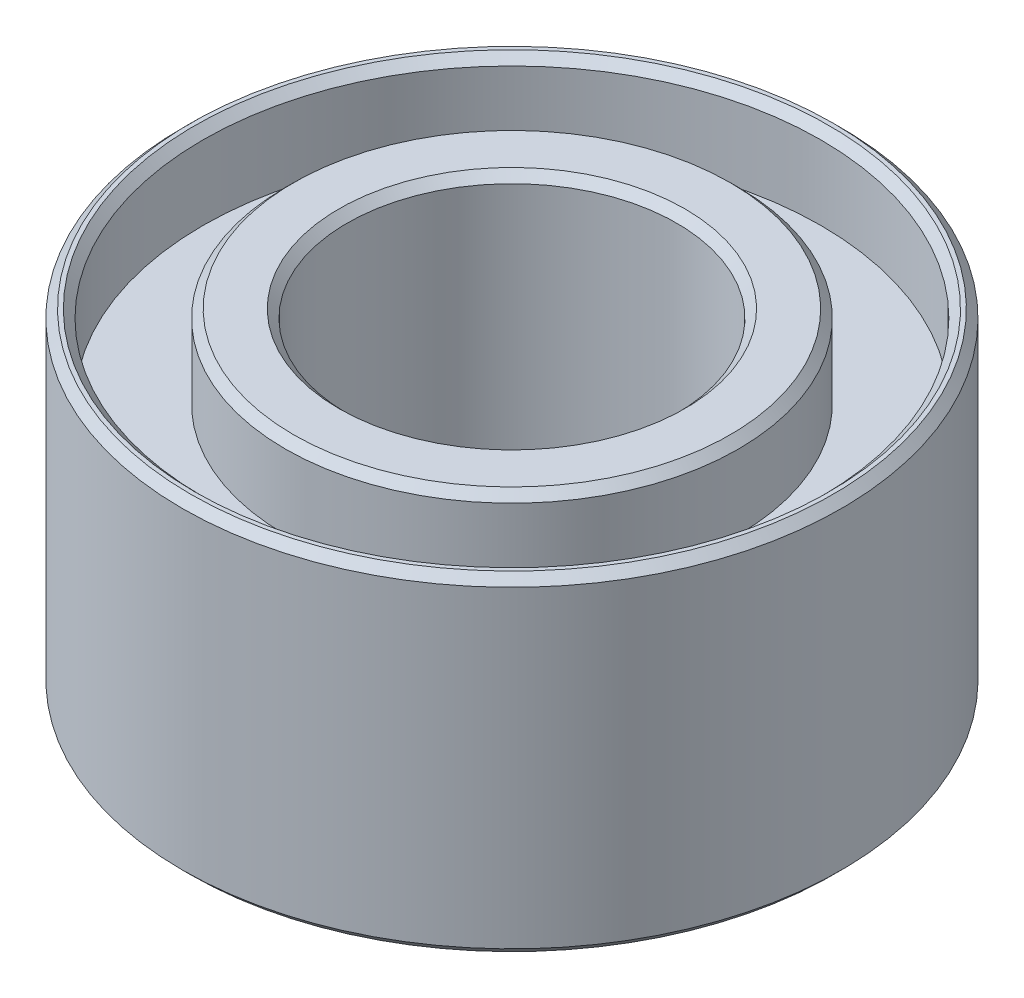
from build123d import *

# Parameters (mm, degrees)
SKETCH1_R           = 4
SKETCH1_R_2         = 2
BOSS_EXTRUDE1_DEPTH = 4
SKETCH2_R           = 3.75
SKETCH2_R_2         = 2.75
CUT_EXTRUDE1_DEPTH  = 1
CUT_EXTRUDE2_START  = -1
SKETCH3_R           = 3.75
SKETCH3_R_2         = 2.75
CUT_EXTRUDE2_DEPTH  = 1
CHAMFER1_SIZE       = 0.1


with BuildPart() as part:
    # Sketch1 → Boss-Extrude1 (new body)
    with BuildSketch(Plane(origin=(0, 0, 0), x_dir=(1, 0, 0), z_dir=(0, 1, 0))):
        with Locations(Location((0, 0, 0), (0, 0, 270))):
            Circle(SKETCH1_R)
        with Locations(Location((0, 0, 0), (0, 0, 270))):
            Circle(SKETCH1_R_2, mode=Mode.SUBTRACT)
    extrude(amount=BOSS_EXTRUDE1_DEPTH)

    # Sketch2 → Cut-Extrude1 (cut)
    with BuildSketch(Plane(origin=(0, 4, 0), x_dir=(1, 0, 0), z_dir=(0, 1, 0))):
        with Locations(Location((0, 0, 0), (0, 0, 270))):
            Circle(SKETCH2_R)
        with Locations(Location((0, 0, 0), (0, 0, 270))):
            Circle(SKETCH2_R_2, mode=Mode.SUBTRACT)
    extrude(amount=-CUT_EXTRUDE1_DEPTH, mode=Mode.SUBTRACT)

    # Sketch3 → Cut-Extrude2 (cut)
    with BuildSketch(Plane.XZ.offset(CUT_EXTRUDE2_START)):
        with Locations(Location((0, 0, 0), (0, 0, 90))):
            Circle(SKETCH3_R)
        with Locations(Location((0, 0, 0), (0, 0, 90))):
            Circle(SKETCH3_R_2, mode=Mode.SUBTRACT)
    extrude(amount=CUT_EXTRUDE2_DEPTH, mode=Mode.SUBTRACT)

    # Chamfer1
    chamfer1_edges = [part.edges().sort_by_distance(p)[0] for p in [
        (0, 4, -3.75),
        (0, 4, -2.75),
        (0, 0, -3.75),
        (0, 0, -4),
        (0, 0, -2.75),
        (0, 4, -4),
        (0, 0, -2),
        (0, 4, -2),
    ]]
    chamfer(chamfer1_edges, length=CHAMFER1_SIZE)


solid = part.part
